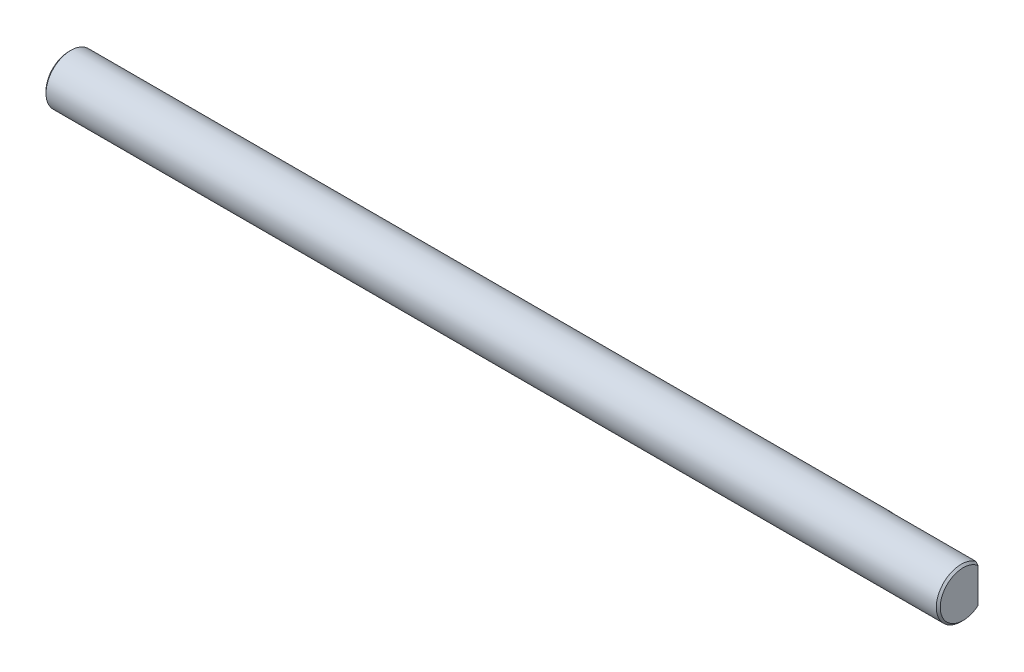
from build123d import *

# Parameters (mm, degrees)
SKETCH1_W               = 90
SKETCH1_H               = 2.5
CUT_EXTRUDE1_DEPTH      = 91.069417673
CUT_EXTRUDE1_DEPTH_BACK = 91.069417673
SKETCH2_W               = 9
SKETCH2_H               = 1
CHAMFER1_SIZE           = 0.2


with BuildPart() as part:
    # Sketch1 → Revolve1 (revolve)
    with BuildSketch(Plane(origin=(0, 0, 0), x_dir=(1, 0, 0), z_dir=(0, 1, 0))):
        with Locations((-45, 1.25)):
            Rectangle(SKETCH1_W, SKETCH1_H)
    revolve(axis=Axis((0, 0, 0), (-1, 0, 0)))

    # Sketch2 → Cut-Extrude1 (cut, two sides: drawn at the far end of the back side and taken through both)
    with BuildSketch(Plane(origin=(0, 0, 0), x_dir=(1, 0, 0), z_dir=(0, 1, 0)).offset(-CUT_EXTRUDE1_DEPTH_BACK)):
        with Locations((-4.5, 2)):
            Rectangle(SKETCH2_W, SKETCH2_H)
    extrude(amount=CUT_EXTRUDE1_DEPTH + CUT_EXTRUDE1_DEPTH_BACK, mode=Mode.SUBTRACT)

    # Chamfer1
    chamfer1_edges = [part.edges().sort_by_distance(p)[0] for p in [
        (-90, 0, 2.5),
        (0, 0, 2.5),
    ]]
    chamfer(chamfer1_edges, length=CHAMFER1_SIZE)


solid = part.part
